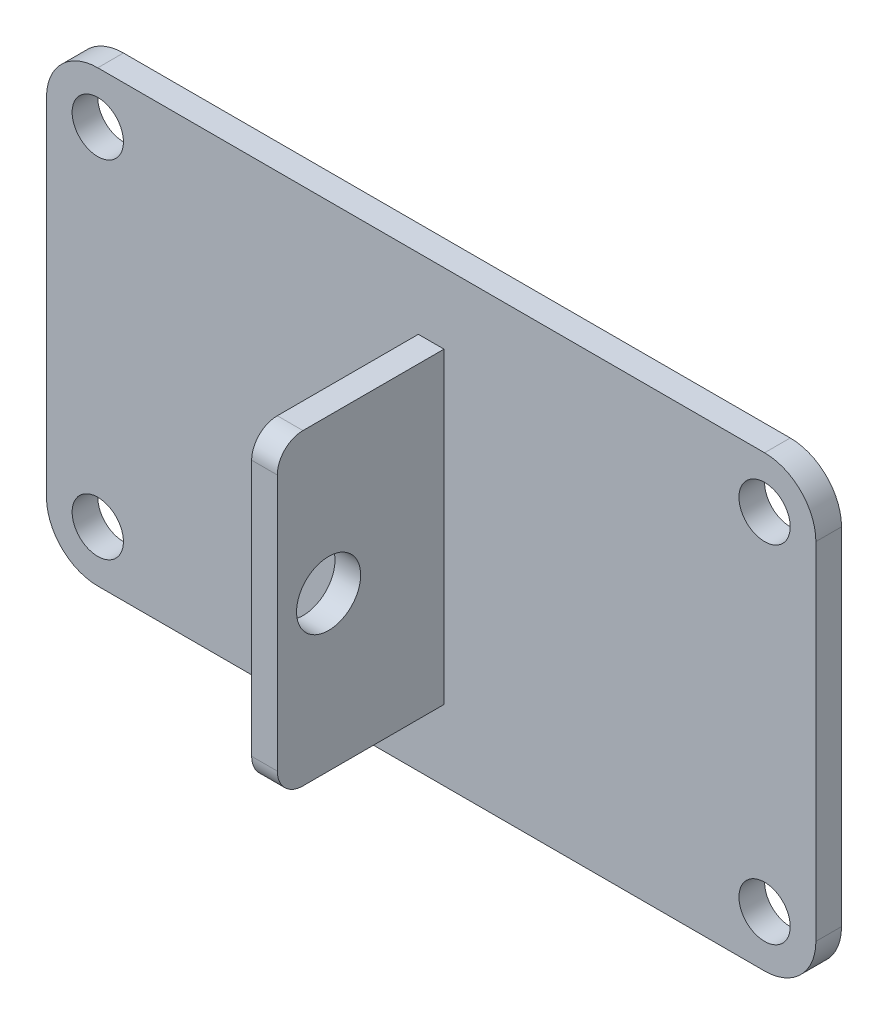
from build123d import *

# Parameters (mm, degrees)
SZKIC1_R                    = 10
DODANIE_WYCI_GNI_CIE1_DEPTH = 10
SZKIC2_W                    = 10
SZKIC2_H                    = 120
DODANIE_WYCI_GNI_CIE2_DEPTH = 65
ZAOKR_GLENIE1_R             = 10
SZKIC4_R                    = 12.5
WYTNIJ_WYCI_GNI_CIE1_DEPTH  = 65


with BuildPart() as part:
    # Szkic1 → Dodanie-wyciągnięcie1 (new body)
    with BuildSketch(Plane.XY):
        with BuildLine():
            Line((-130, 87.5), (130, 87.5))
            ThreePointArc((130, 87.5), (144.142135624, 81.642135624), (150, 67.5))
            Line((150, 67.5), (150, -67.5))
            ThreePointArc((150, -67.5), (144.142135624, -81.642135624), (130, -87.5))
            Line((130, -87.5), (-130, -87.5))
            ThreePointArc((-130, -87.5), (-144.142135624, -81.642135624), (-150, -67.5))
            Line((-150, -67.5), (-150, 67.5))
            ThreePointArc((-150, 67.5), (-144.142135624, 81.642135624), (-130, 87.5))
        make_face()
        with Locations((-130, 67.5)):
            Circle(SZKIC1_R, mode=Mode.SUBTRACT)
        with Locations((-130, -67.5)):
            Circle(SZKIC1_R, mode=Mode.SUBTRACT)
        with Locations((130, -67.5)):
            Circle(SZKIC1_R, mode=Mode.SUBTRACT)
        with Locations((130, 67.5)):
            Circle(SZKIC1_R, mode=Mode.SUBTRACT)
    extrude(amount=DODANIE_WYCI_GNI_CIE1_DEPTH)

    # Szkic2 → Dodanie-wyciągnięcie2 (add)
    with BuildSketch(Plane.XY.offset(10)):
        Rectangle(SZKIC2_W, SZKIC2_H)
    extrude(amount=DODANIE_WYCI_GNI_CIE2_DEPTH)

    # Zaokrąglenie1
    zaokr_glenie1_edges = [part.edges().sort_by_distance(p)[0] for p in [
        (0, 60, 75),
        (0, -60, 75),
    ]]
    fillet(zaokr_glenie1_edges, radius=ZAOKR_GLENIE1_R)

    # Szkic4 → Wytnij-wyciągnięcie1 (cut)
    with BuildSketch(Plane(origin=(5, 0, 0), x_dir=(0, 0, -1), z_dir=(1, 0, 0))):
        with Locations(Location((-55, 0, 0), (0, 0, 90))):
            Circle(SZKIC4_R)
    extrude(amount=-WYTNIJ_WYCI_GNI_CIE1_DEPTH, mode=Mode.SUBTRACT)


solid = part.part
